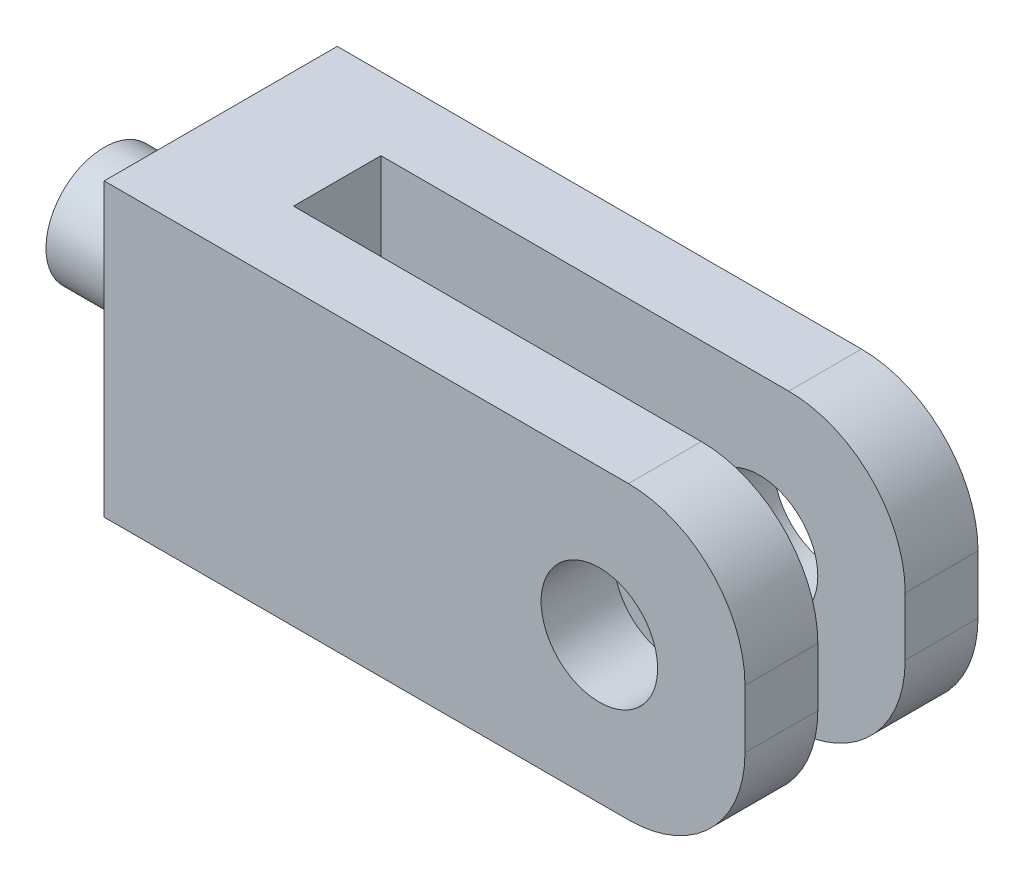
from build123d import *

# Parameters (mm, degrees)
SKETCH1_W           = 110
SKETCH1_H           = 50
BOSS_EXTRUDE1_DEPTH = 40
SKETCH2_W           = 15
SKETCH2_H           = 50
CUT_EXTRUDE1_DEPTH  = 90
FILLET1_R           = 20
SKETCH3_R           = 10
CUT_EXTRUDE2_DEPTH  = 73.456883731
SKETCH4_R           = 10
BOSS_EXTRUDE2_DEPTH = 20


with BuildPart() as part:
    # Sketch1 → Boss-Extrude1 (new body)
    with BuildSketch(Plane.XY):
        Rectangle(SKETCH1_W, SKETCH1_H)
    extrude(amount=BOSS_EXTRUDE1_DEPTH)

    # Sketch2 → Cut-Extrude1 (cut)
    with BuildSketch(Plane(origin=(55, 0, 0), x_dir=(0, 0, -1), z_dir=(1, 0, 0))):
        with Locations((-20, 0)):
            Rectangle(SKETCH2_W, SKETCH2_H)
    extrude(amount=-CUT_EXTRUDE1_DEPTH, mode=Mode.SUBTRACT)

    # Fillet1
    fillet1_edges = [part.edges().sort_by_distance(p)[0] for p in [
        (55, -25, 6.25),
        (55, 25, 6.25),
        (55, -25, 33.75),
        (55, 25, 33.75),
    ]]
    fillet(fillet1_edges, radius=FILLET1_R)

    # Sketch3 → Cut-Extrude2 (cut, through all)
    with BuildSketch(Plane.XY.offset(40)):
        with Locations((30, 0)):
            Circle(SKETCH3_R)
    extrude(amount=-CUT_EXTRUDE2_DEPTH, mode=Mode.SUBTRACT)

    # Sketch4 → Boss-Extrude2 (add)
    with BuildSketch(Plane.ZY.offset(55)):
        with Locations(Location((20, 0, 0), (0, 0, 270))):
            Circle(SKETCH4_R)
    extrude(amount=BOSS_EXTRUDE2_DEPTH)


solid = part.part
